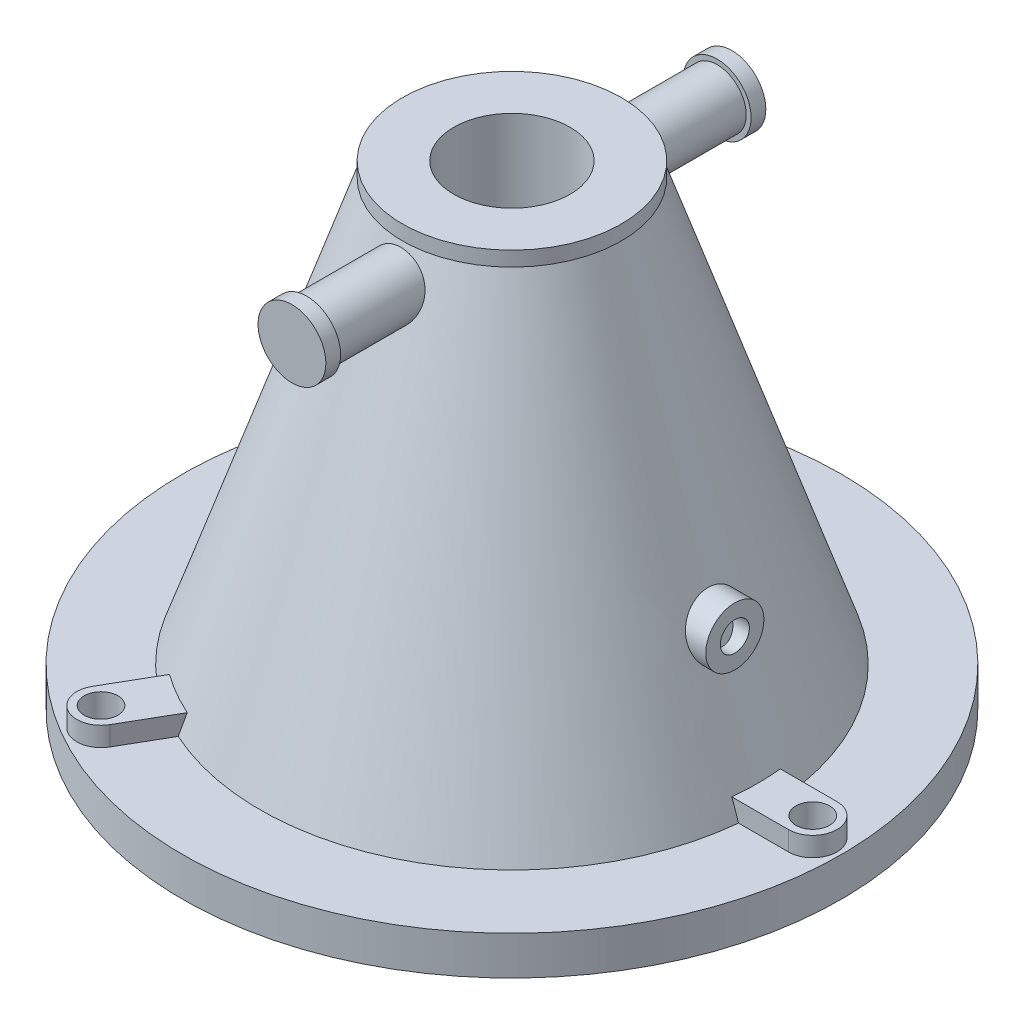
from build123d import *

# Parameters (mm, degrees)
BOSS_EXTRUDE1_START = 5.75
SKETCH5_R           = 0.75
SKETCH5_R_2         = 0.375
BOSS_EXTRUDE1_DEPTH = 1.62
BOSS_EXTRUDE2_DEPTH = 0.5
SKETCH10_R          = 0.435
CUT_EXTRUDE1_DEPTH  = 17.126453423
CIRPATTERN2_COUNT   = 3
BOSS_EXTRUDE4_START = 5.675
SKETCH11_R          = 0.875
BOSS_EXTRUDE4_DEPTH = 0.38
BOSS_EXTRUDE6_REACH = 22.312
BOSS_EXTRUDE6_START = 5.295
SKETCH11_5_R        = 0.75


with BuildPart() as part:
    # Sketch1 → Revolve1 (revolve)
    with BuildSketch(Plane.XY):
        with BuildLine():
            Line((1.5, 0), (2.25, 0))
            Line((2.25, 0), (2.375, 4.956991452))
            ThreePointArc((2.375, 4.956991452), (2.799921643, 5.438742215), (3.348503009, 5.104525689))
            Line((3.348503009, 5.104525689), (6.173055163, -3.25))
            Line((6.173055163, -3.25), (8.5, -3.25))
            Line((8.5, -3.25), (8.5, -2.25))
            Line((8.5, -2.25), (6.5, -2.25))
            Line((6.5, -2.25), (2.825, 8.62))
            Line((2.825, 8.62), (2.825, 9))
            Line((2.825, 9), (1.5, 9))
            Line((1.5, 9), (1.5, 0))
        make_face()
    revolve(axis=Axis((0, 0, 0), (0, 1, 0)))

    # Sketch5 → Boss-Extrude1 (add)
    with BuildSketch(Plane(origin=(0, 0, 0), x_dir=(0, 0, -1), z_dir=(1, 0, 0)).offset(BOSS_EXTRUDE1_START)):
        with Locations((0, 1.25)):
            Circle(SKETCH5_R)
        with Locations((0, 1.25)):
            Circle(SKETCH5_R_2, mode=Mode.SUBTRACT)
    extrude(amount=-BOSS_EXTRUDE1_DEPTH)

    # Sketch8 → Boss-Extrude2 (add)
    with BuildSketch(Plane(origin=(0, -2.25, 0), x_dir=(1, 0, 0), z_dir=(0, 1, 0))):
        with BuildLine():
            Line((7.76, 0.625), (6.183525085, 0.625))
            Line((6.183525085, 0.625), (6.183525085, -0.625))
            Line((6.183525085, -0.625), (7.76, -0.625))
            ThreePointArc((7.76, -0.625), (8.385, 0), (7.76, 0.625))
        make_face()
    boss_extrude2 = extrude(amount=BOSS_EXTRUDE2_DEPTH)

    # Sketch10 → Cut-Extrude1 (cut, through all)
    with BuildSketch(Plane(origin=(0, -1.75, 0), x_dir=(1, 0, 0), z_dir=(0, 1, 0))):
        with Locations((7.76, 0)):
            Circle(SKETCH10_R)
    cut_extrude1 = extrude(amount=-CUT_EXTRUDE1_DEPTH, mode=Mode.SUBTRACT)

    # CirPattern2: Boss-Extrude2, Cut-Extrude1 ×3 about axis
    cirpattern2_axis = Axis((0, -2.25, 0), (0, -1, 0))
    add([boss_extrude2.rotate(cirpattern2_axis, i * 360 / CIRPATTERN2_COUNT) for i in range(1, CIRPATTERN2_COUNT)])
    add([cut_extrude1.rotate(cirpattern2_axis, i * 360 / CIRPATTERN2_COUNT) for i in range(1, CIRPATTERN2_COUNT)], mode=Mode.SUBTRACT)


with BuildPart() as body_2:
    # Sketch11 → Boss-Extrude4 (new body)
    with BuildSketch(Plane.XY.offset(BOSS_EXTRUDE4_START)):
        with Locations((0, 7.75)):
            Circle(SKETCH11_R)
    extrude(amount=-BOSS_EXTRUDE4_DEPTH)


with BuildPart() as body_3:

    # Sketch11<5> → Boss-Extrude6 (new, up to next)
    with BuildSketch(Plane.XY.offset(BOSS_EXTRUDE6_START), mode=Mode.PRIVATE) as boss_extrude6_sk1:
        with Locations((0, 7.75)):
            Circle(SKETCH11_5_R)
    boss_extrude6_tool1 = extrude(boss_extrude6_sk1.sketch, amount=-BOSS_EXTRUDE6_REACH, mode=Mode.PRIVATE) - part.part
    add(boss_extrude6_tool1.solids().sort_by_distance((0, 7.75, 5.295))[0])


with BuildPart() as body_4:
    # Mirror5: mirrored copy
    add(body_3.part.mirror(Plane.XY))


with BuildPart() as body_5:
    # Mirror5 2: mirrored copy
    add(body_2.part.mirror(Plane.XY))


solid = Compound([part.part, body_2.part, body_3.part, body_4.part, body_5.part])
